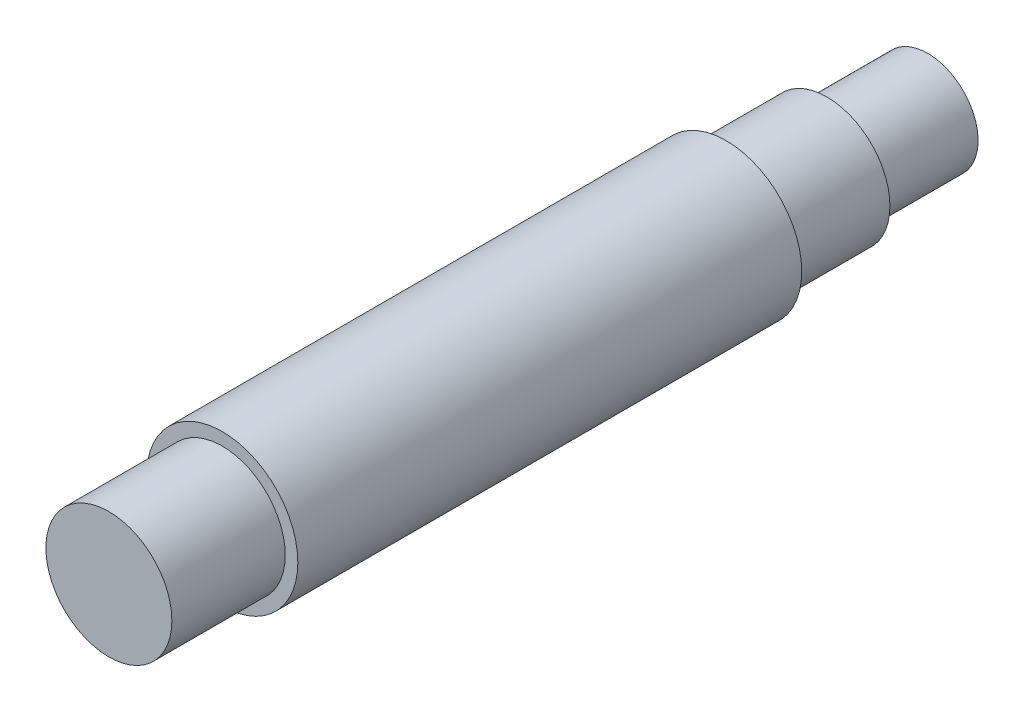
from build123d import *

# Parameters (mm, degrees)
SKETCH_1_R      = 6
EXTRUDE_1_DEPTH = 40
SKETCH_2_R      = 5
EXTRUDE_2_DEPTH = 9
EXTRUDE_START   = 8
SKETCH_4_R      = 5
EXTRUDE_4_DEPTH = 8
SKETCH_6_R      = 4
EXTRUDE_6_DEPTH = 8


with BuildPart() as part:
    # 草图1 → 凸台-拉伸1 (new body)
    with BuildSketch(Plane.XY):
        Circle(SKETCH_1_R)
    extrude(amount=EXTRUDE_1_DEPTH)

    # 草图2 → 凸台-拉伸2 (add)
    with BuildSketch(Plane.XY.offset(40)):
        Circle(SKETCH_2_R)
    extrude(amount=EXTRUDE_2_DEPTH)

    # 草图4 → 凸台-拉伸4 (add)
    with BuildSketch(Plane(origin=(0, 0, 0), x_dir=(-1, 0, 0), z_dir=(0, 0, -1)).offset(EXTRUDE_START)):
        with Locations(Location((0, 0, 0), (0, 0, 180))):
            Circle(SKETCH_4_R)
    extrude(amount=-EXTRUDE_4_DEPTH)

    # 草图6 → 凸台-拉伸6 (add)
    with BuildSketch(Plane(origin=(0, 0, -8), x_dir=(-1, 0, 0), z_dir=(0, 0, -1))):
        Circle(SKETCH_6_R)
    extrude(amount=EXTRUDE_6_DEPTH)


solid = part.part
